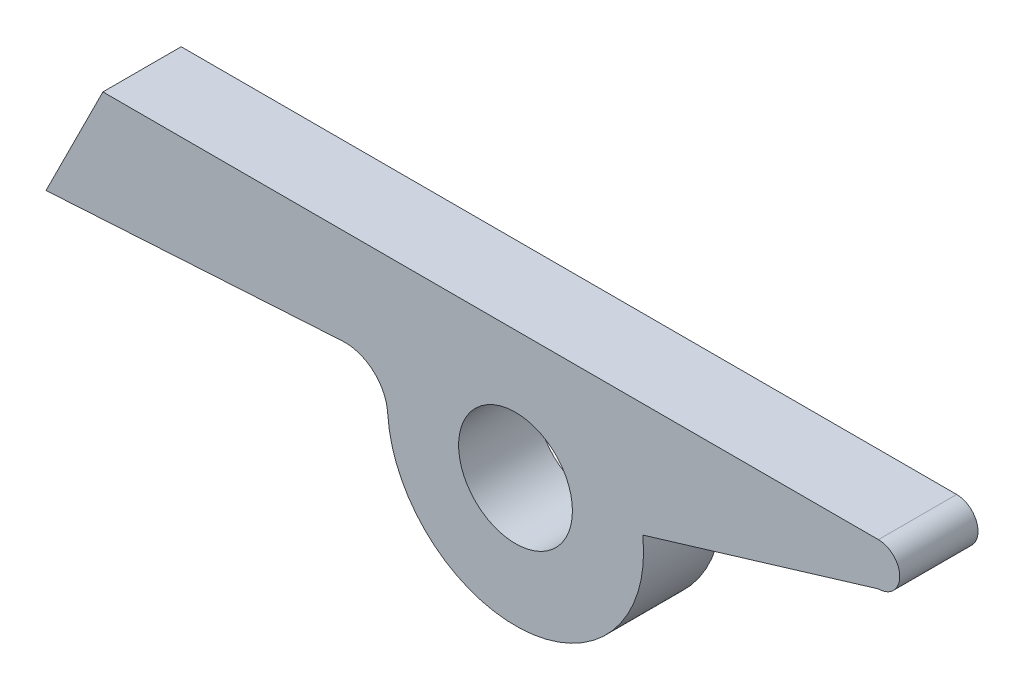
from build123d import *

# Parameters (mm, degrees)
SCHIZZO1_R                   = 4
ESTRUSIONE_ESTRUSIONE1_DEPTH = 5.5


with BuildPart() as part:
    # Schizzo1 → Estrusione-Estrusione1 (new body)
    with BuildSketch(Plane.XY):
        with BuildLine():
            Line((-27.25, 0), (27.25, 0))
            ThreePointArc((27.25, 0), (28.75, -1.5), (27.25, -3))
            Line((27.25, -3), (10.69143351, -8))
            ThreePointArc((10.69143351, -8), (2.524901098, -17.966332655), (-7.2357096, -9.555))
            ThreePointArc((-7.2357096, -9.555), (-8.241759605, -7.493469312), (-10.410277522, -6.745421563))
            Line((-10.410277522, -6.745421563), (-31.25, -8))
            Line((-31.25, -8), (-27.25, 0))
        make_face()
        with Locations((1.7471616, -9)):
            Circle(SCHIZZO1_R, mode=Mode.SUBTRACT)
    extrude(amount=ESTRUSIONE_ESTRUSIONE1_DEPTH)


solid = part.part
